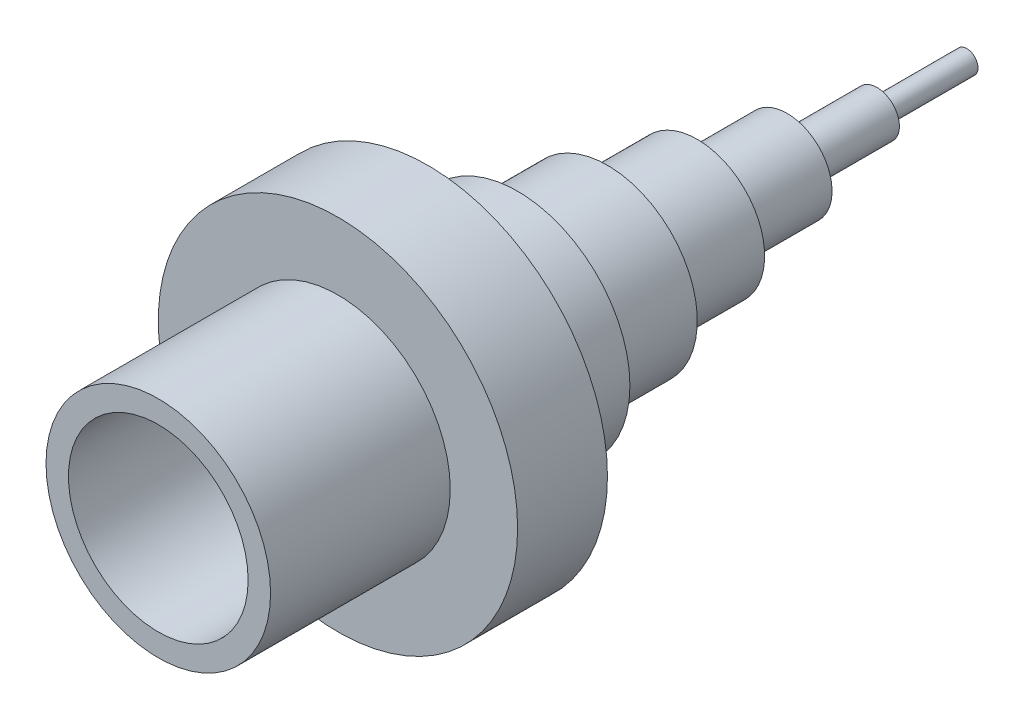
from build123d import *

# Parameters (mm, degrees)
SKETCH2_R           = 1016
BOSS_EXTRUDE1_DEPTH = 508
SKETCH3_R           = 635
SKETCH3_R_2         = 508
BOSS_EXTRUDE2_DEPTH = 1016
BOSS_EXTRUDE3_START = 508
SKETCH4_R           = 635
BOSS_EXTRUDE3_DEPTH = 508
BOSS_EXTRUDE4_START = 508
SKETCH5_R           = 508
BOSS_EXTRUDE4_DEPTH = 508
SKETCH7_R           = 381
BOSS_EXTRUDE5_DEPTH = 508
SKETCH8_R           = 254
BOSS_EXTRUDE6_DEPTH = 508
SKETCH9_R           = 127
BOSS_EXTRUDE7_DEPTH = 508
SKETCH10_R          = 63.5
BOSS_EXTRUDE8_DEPTH = 508


with BuildPart() as part:
    # Sketch2 → Boss-Extrude1 (new body)
    with BuildSketch(Plane.XY):
        Circle(SKETCH2_R)
    extrude(amount=BOSS_EXTRUDE1_DEPTH)

    # Sketch3 → Boss-Extrude2 (add)
    with BuildSketch(Plane.XY.offset(508)):
        Circle(SKETCH3_R)
        Circle(SKETCH3_R_2, mode=Mode.SUBTRACT)
    extrude(amount=BOSS_EXTRUDE2_DEPTH)

    # Sketch4 → Boss-Extrude3 (add)
    with BuildSketch(Plane(origin=(0, 0, 0), x_dir=(-1, 0, 0), z_dir=(0, 0, -1)).offset(BOSS_EXTRUDE3_START)):
        with Locations(Location((0, 0, 0), (0, 0, 180))):
            Circle(SKETCH4_R)
    extrude(amount=-BOSS_EXTRUDE3_DEPTH)

    # Sketch5 → Boss-Extrude4 (add)
    with BuildSketch(Plane(origin=(0, 0, -508), x_dir=(-1, 0, 0), z_dir=(0, 0, -1)).offset(BOSS_EXTRUDE4_START)):
        with Locations(Location((0, 0, 0), (0, 0, 180))):
            Circle(SKETCH5_R)
    extrude(amount=-BOSS_EXTRUDE4_DEPTH)

    # Sketch7 → Boss-Extrude5 (add)
    with BuildSketch(Plane(origin=(0, 0, -1016), x_dir=(-1, 0, 0), z_dir=(0, 0, -1))):
        Circle(SKETCH7_R)
    extrude(amount=BOSS_EXTRUDE5_DEPTH)

    # Sketch8 → Boss-Extrude6 (add)
    with BuildSketch(Plane(origin=(0, 0, -1524), x_dir=(-1, 0, 0), z_dir=(0, 0, -1))):
        Circle(SKETCH8_R)
    extrude(amount=BOSS_EXTRUDE6_DEPTH)

    # Sketch9 → Boss-Extrude7 (add)
    with BuildSketch(Plane(origin=(0, 0, -2032), x_dir=(-1, 0, 0), z_dir=(0, 0, -1))):
        Circle(SKETCH9_R)
    extrude(amount=BOSS_EXTRUDE7_DEPTH)

    # Sketch10 → Boss-Extrude8 (add)
    with BuildSketch(Plane(origin=(0, 0, -2540), x_dir=(-1, 0, 0), z_dir=(0, 0, -1))):
        Circle(SKETCH10_R)
    extrude(amount=BOSS_EXTRUDE8_DEPTH)


solid = part.part
